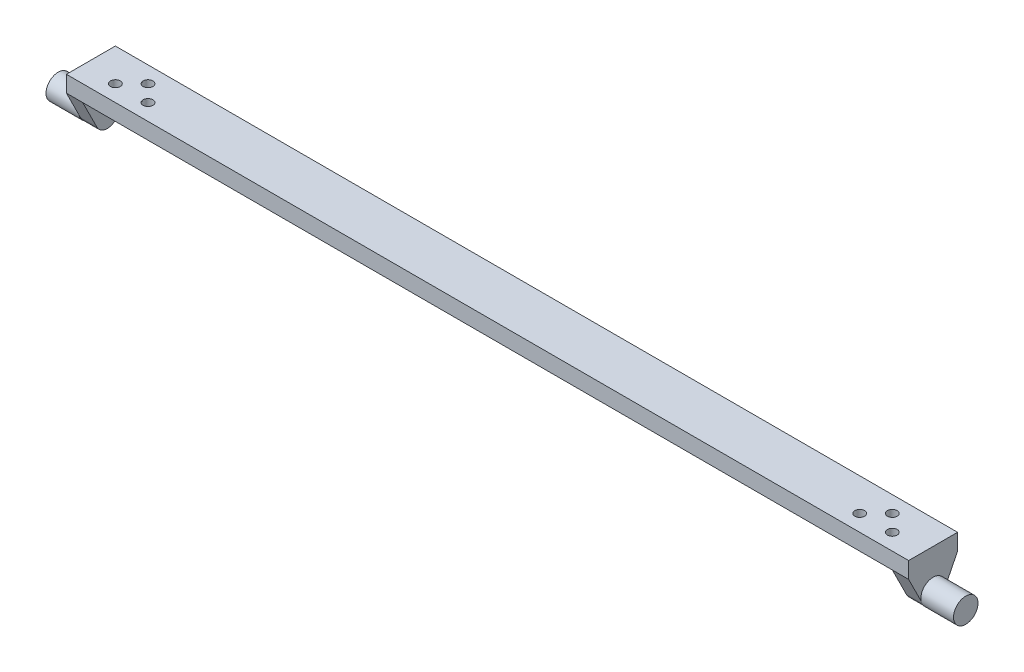
from build123d import *

# Parameters (mm, degrees)
SKETCH1_W           = 248
SKETCH1_H           = 15
BOSS_EXTRUDE1_DEPTH = 5
SKETCH2_R           = 1.5
CUT_EXTRUDE1_DEPTH  = 5
BOSS_EXTRUDE2_DEPTH = 5
FILLET1_R           = 3.5
SKETCH4_R           = 3.75
BOSS_EXTRUDE3_DEPTH = 10
BOSS_EXTRUDE4_DEPTH = 5
FILLET2_R           = 3.5
BOSS_EXTRUDE5_START = 10
SKETCH6_R           = 3.75
BOSS_EXTRUDE5_DEPTH = 10


with BuildPart() as part:
    # Sketch1 → Boss-Extrude1 (new body)
    with BuildSketch(Plane(origin=(0, 0, 0), x_dir=(1, 0, 0), z_dir=(0, 1, 0))):
        with Locations((76.611924132, -7.165740151)):
            Rectangle(SKETCH1_W, SKETCH1_H)
    extrude(amount=BOSS_EXTRUDE1_DEPTH)

    # Sketch2 → Cut-Extrude1 (cut)
    with BuildSketch(Plane(origin=(0, 5, 0), x_dir=(1, 0, 0), z_dir=(0, 1, 0))):
        with Locations(Location((-42.388075868, -9.665740151, 0), (0, 0, 270))):
            Circle(SKETCH2_R)
        with Locations(Location((-37.388075868, -4.665740151, 0), (0, 0, 270))):
            Circle(SKETCH2_R)
        with Locations(Location((-32.388075868, -9.665740151, 0), (0, 0, 270))):
            Circle(SKETCH2_R)
        with Locations(Location((185.611924132, -9.665740151, 0), (0, 0, 270))):
            Circle(SKETCH2_R)
        with Locations(Location((190.611924132, -4.665740151, 0), (0, 0, 270))):
            Circle(SKETCH2_R)
        with Locations(Location((195.611924132, -9.665740151, 0), (0, 0, 270))):
            Circle(SKETCH2_R)
    extrude(amount=-CUT_EXTRUDE1_DEPTH, mode=Mode.SUBTRACT)

    # Sketch3 → Boss-Extrude2 (add)
    with BuildSketch(Plane(origin=(200.611924132, 0, 0), x_dir=(0, 0, -1), z_dir=(1, 0, 0))):
        Polygon((0.334259849, 0), (0.334259849, 5), (-14.665740151, 5), (-14.665740151, 0), (-7.165740151, -15), align=None)
    extrude(amount=BOSS_EXTRUDE2_DEPTH)

    # Fillet1
    fillet1_edges = [part.edges().sort_by_distance(p)[0] for p in [
        (203.111924132, -15, 7.165740151),
    ]]
    fillet(fillet1_edges, radius=FILLET1_R)

    # Sketch4 → Boss-Extrude3 (add)
    with BuildSketch(Plane(origin=(205.611924132, 0, 0), x_dir=(0, 0, -1), z_dir=(1, 0, 0))):
        with Locations(Location((-7.165740151, -6.923762079, 0), (0, 0, 190.96185694))):
            Circle(SKETCH4_R)
    extrude(amount=BOSS_EXTRUDE3_DEPTH)

    # Sketch5 → Boss-Extrude4 (add)
    with BuildSketch(Plane.ZY.offset(47.388075868)):
        Polygon((-0.334259849, 0), (-0.334259849, 5), (14.665740151, 5), (14.665740151, 0), (7.165740151, -15), align=None)
    extrude(amount=BOSS_EXTRUDE4_DEPTH)

    # Fillet2
    fillet2_edges = [part.edges().sort_by_distance(p)[0] for p in [
        (-49.888075868, -15, 7.165740151),
    ]]
    fillet(fillet2_edges, radius=FILLET2_R)

    # Sketch6 → Boss-Extrude5 (add)
    with BuildSketch(Plane.ZY.offset(52.388075868).offset(BOSS_EXTRUDE5_START)):
        with Locations(Location((7.165740151, -6.923762079, 0), (0, 0, 349.03814306))):
            Circle(SKETCH6_R)
    extrude(amount=-BOSS_EXTRUDE5_DEPTH)


solid = part.part
